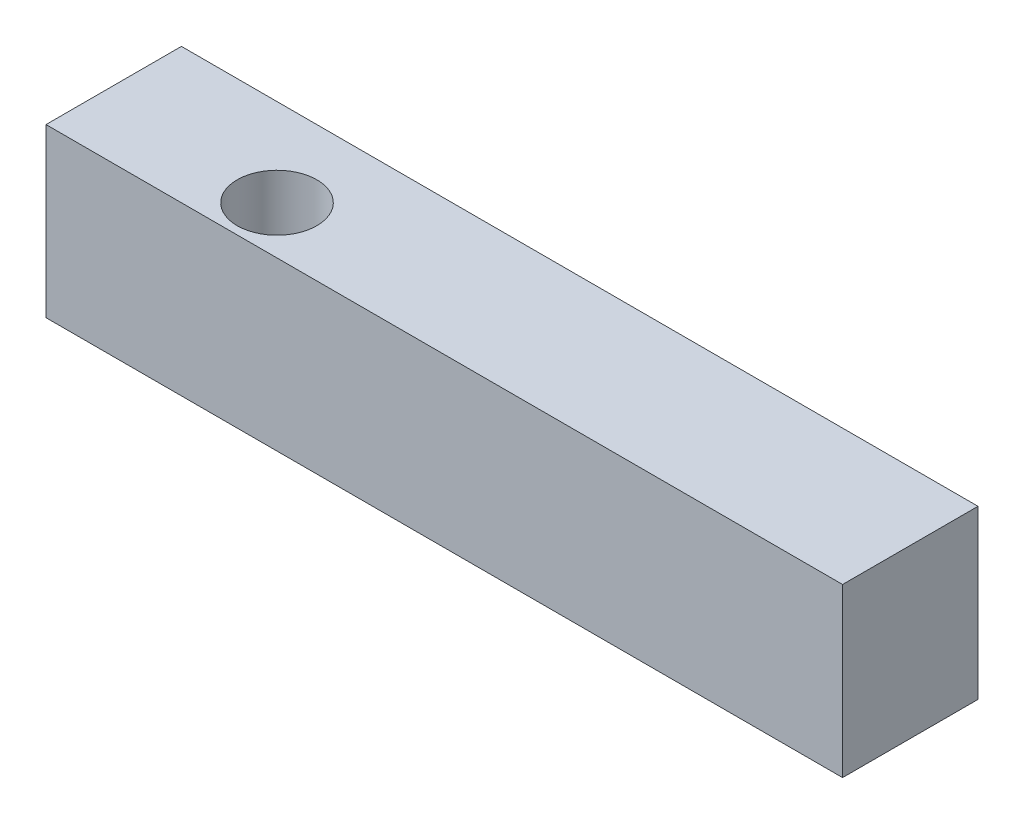
from build123d import *

# Parameters (mm, degrees)
SKETCH1_W           = 25.4
SKETCH1_H           = 5.334
BOSS_EXTRUDE1_DEPTH = 4.318
SKETCH2_R           = 1.27
CUT_EXTRUDE2_DEPTH  = 22.718057664


with BuildPart() as part:
    # Sketch1 → Boss-Extrude1 (new body)
    with BuildSketch(Plane.XY):
        with Locations((7.905274778, -0.284534644)):
            Rectangle(SKETCH1_W, SKETCH1_H)
    extrude(amount=BOSS_EXTRUDE1_DEPTH)

    # Sketch2 → Cut-Extrude2 (cut, through all)
    with BuildSketch(Plane(origin=(0, 2.382465356, 0), x_dir=(1, 0, 0), z_dir=(0, 1, 0))):
        with Locations(Location((1.047274778, -2.794, 0), (0, 0, 270))):
            Circle(SKETCH2_R)
    extrude(amount=-CUT_EXTRUDE2_DEPTH, mode=Mode.SUBTRACT)


solid = part.part
